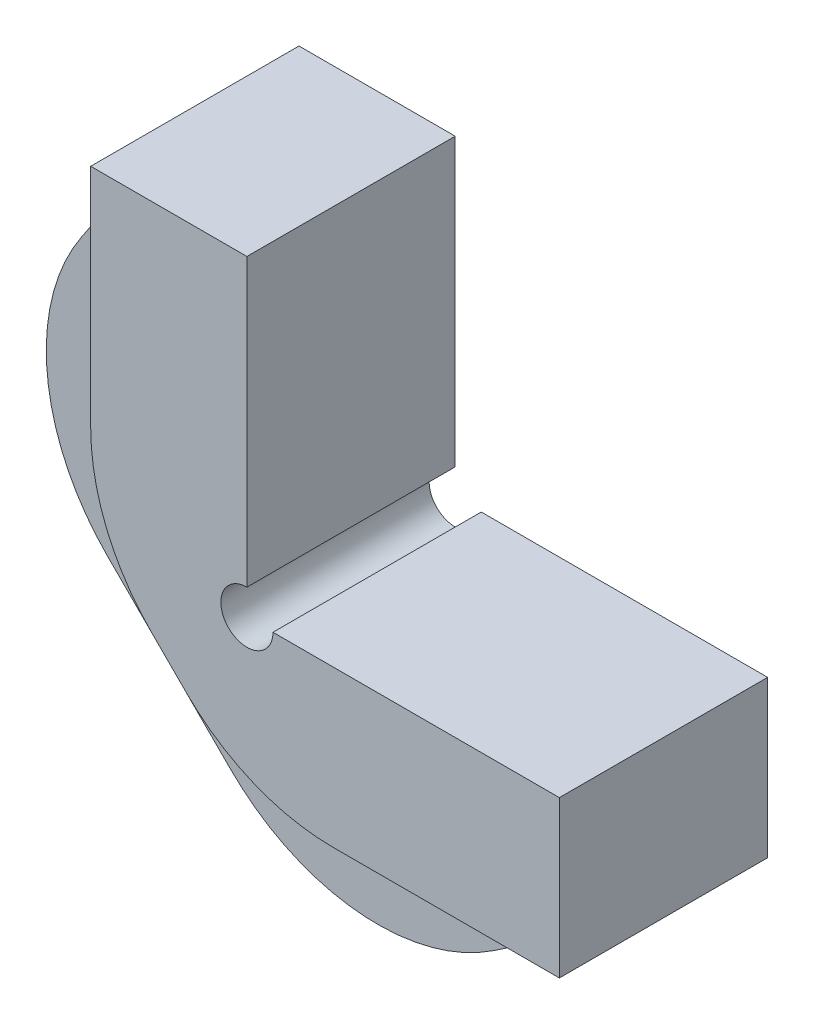
from build123d import *

# Parameters (mm, degrees)
ESTRUSIONE_ESTRUSIONE1_DEPTH = 20
ESTRUSIONE_ESTRUSIONE3_DEPTH = 10
TAGLIO_ESTRUSIONE2_DEPTH     = 51.497524692
SMUSSO2_SIZE                 = 3
RACCORDO3_R                  = 20


with BuildPart() as part:
    # Schizzo1 → Estrusione-Estrusione1 (new body)
    with BuildSketch(Plane.XY):
        with BuildLine():
            Line((-15, 0), (0, -15))
            Line((0, -15), (30, -15))
            Line((30, -15), (30, 0))
            Line((30, 0), (2.5, 0))
            ThreePointArc((2.5, 0), (-1.767766953, -1.767766953), (0, 2.5))
            Line((0, 2.5), (0, 30))
            Line((0, 30), (-15, 30))
            Line((-15, 30), (-15, 0))
        make_face()
    extrude(amount=ESTRUSIONE_ESTRUSIONE1_DEPTH)

    # Schizzo2 → Estrusione-Estrusione3 (add)
    with BuildSketch(Plane(origin=(0, 0, 0), x_dir=(-1, 0, 0), z_dir=(0, 0, -1))):
        Polygon((35, 0), (15, 30), (15, 0), (0, -15), (-30, -15), (0, -35), align=None)
    extrude(amount=-ESTRUSIONE_ESTRUSIONE3_DEPTH)

    # Schizzo4 → Taglio-Estrusione2 (cut, through all)
    with BuildSketch(Plane.XY.offset(10)):
        with BuildLine():
            ThreePointArc((-9.5, -12.5), (-9.728361402, -11.351949703), (-10.378679656, -10.378679656))
            Line((-10.378679656, -10.378679656), (-14.621320344, -14.621320344))
            ThreePointArc((-14.621320344, -14.621320344), (-11.351949703, -15.271638598), (-9.5, -12.5))
        make_face()
        with BuildLine():
            Line((-14.621320344, -14.621320344), (-10.378679656, -10.378679656))
            ThreePointArc((-10.378679656, -10.378679656), (-14.621320344, -10.378679656), (-14.621320344, -14.621320344))
        make_face()
    extrude(amount=-TAGLIO_ESTRUSIONE2_DEPTH, mode=Mode.SUBTRACT)

    # Smusso2
    smusso2_edges = [part.edges().sort_by_distance(p)[0] for p in [
        (-10.378679656, -10.378679656, 10),
    ]]
    chamfer(smusso2_edges, length=SMUSSO2_SIZE)

    # Raccordo3
    raccordo3_edges = [part.edges().sort_by_distance(p)[0] for p in [
        (0, -15, 15),
        (-15, 0, 15),
        (-35, 0, 5),
        (0, -35, 5),
    ]]
    fillet(raccordo3_edges, radius=RACCORDO3_R)


solid = part.part
